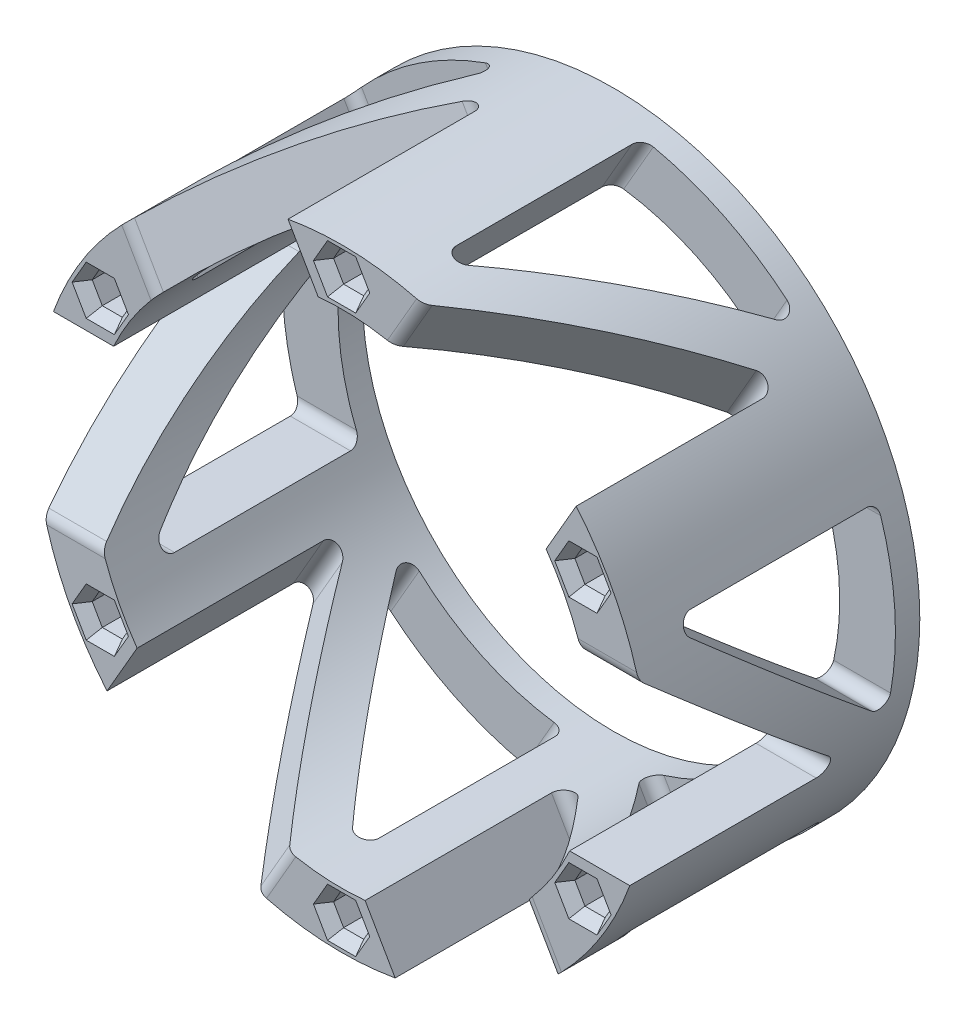
from build123d import *
from OCP.BRepFilletAPI import BRepFilletAPI_MakeChamfer

# Parameters (mm, degrees)
SKETCH_1_R                       = 44
SKETCH_1_R_2                     = 36
EXTRUDE_1_DEPTH                  = 39
CUT_EXTRUDE_6_DEPTH              = 59
FILLET_1_R                       = 2
PATTERN_CIRCULAR_1_COUNT         = 6
FILLET_1_OF_PATTERN_CIRCULAR_1_R = 2
SKETCH_8_R                       = 1.6
EXTRUDE_2_DEPTH                  = 6.7
CHAMFER_1_SIZE                   = 1
CHAMFER_1_SIZE2                  = 1.732050808


with BuildPart() as part:
    # 草图1 → 凸台-拉伸1 (new body)
    with BuildSketch(Plane.XY):
        Circle(SKETCH_1_R)
        Circle(SKETCH_1_R_2, mode=Mode.SUBTRACT)
        Polygon((36.084391824, 17.5), (37.527767497, 20), (36.084391824, 22.5), (33.197640478, 22.5), (31.754264805, 20), (33.197640478, 17.5), align=None, mode=Mode.SUBTRACT)
        Polygon((2.886751346, 40), (1.443375673, 42.5), (-1.443375673, 42.5), (-2.886751346, 40), (-1.443375673, 37.5), (1.443375673, 37.5), align=None, mode=Mode.SUBTRACT)
        Polygon((33.197640478, -22.5), (36.084391824, -22.5), (37.527767497, -20), (36.084391824, -17.5), (33.197640478, -17.5), (31.754264805, -20), align=None, mode=Mode.SUBTRACT)
        Polygon((-2.886751346, -40), (-1.443375673, -42.5), (1.443375673, -42.5), (2.886751346, -40), (1.443375673, -37.5), (-1.443375673, -37.5), align=None, mode=Mode.SUBTRACT)
        Polygon((-36.084391824, -17.5), (-37.527767497, -20), (-36.084391824, -22.5), (-33.197640478, -22.5), (-31.754264805, -20), (-33.197640478, -17.5), align=None, mode=Mode.SUBTRACT)
        Polygon((-33.197640478, 22.5), (-36.084391824, 22.5), (-37.527767497, 20), (-36.084391824, 17.5), (-33.197640478, 17.5), (-31.754264805, 20), align=None, mode=Mode.SUBTRACT)
    extrude(amount=EXTRUDE_1_DEPTH)

    # 草图7 → 切除-拉伸6 (cut)
    with BuildSketch(Plane(origin=(0, 0, 0), x_dir=(0, 0, -1), z_dir=(1, 0, 0))):
        with BuildLine():
            Line((-30.253226553, -15), (-5, -15))
            ThreePointArc((-5, -15), (-3.939339828, -14.560660172), (-3.5, -13.5))
            Line((-3.5, -13.5), (-3.5, 7.840754833))
            ThreePointArc((-3.5, 7.840754833), (-4.368448226, 9.201321758), (-5.968189809, 8.986446107))
            Line((-5.968189809, 8.986446107), (-31.221416361, -12.354308726))
            ThreePointArc((-31.221416361, -12.354308726), (-31.661867194, -14.015491556), (-30.253226553, -15))
        make_face()
        with BuildLine():
            Line((-39, -11.072240311), (-39, 15))
            Line((-39, 15), (-12.246773447, 15))
            ThreePointArc((-12.246773447, 15), (-10.838132806, 14.015491556), (-11.278583639, 12.354308726))
            Line((-11.278583639, 12.354308726), (-39, -11.072240311))
        make_face()
    cut_extrude_6 = extrude(amount=-CUT_EXTRUDE_6_DEPTH, mode=Mode.SUBTRACT)

    # 圆角1
    fillet_1_edges = [part.edges().sort_by_distance(p)[0] for p in [
        (-38.419552967, -11.072240311, 39),
    ]]
    fillet(fillet_1_edges, radius=FILLET_1_R)

    # 阵列(圆周)1: 切除-拉伸6 ×6 about axis
    pattern_circular_1_axis = Axis((0, 0, 0), (0, 0, 1))
    for i in range(1, PATTERN_CIRCULAR_1_COUNT):
        add(cut_extrude_6.rotate(pattern_circular_1_axis, i * 360 / PATTERN_CIRCULAR_1_COUNT), mode=Mode.SUBTRACT)

    # 圆角1 of 阵列(圆周)1
    fillet_1_of_pattern_circular_1_edges = [part.edges().sort_by_distance(p)[0] for p in [
        (-9.620935097, -38.808429027, 39),
        (28.79861787, -27.736188715, 39),
        (38.419552967, 11.072240311, 39),
        (9.620935097, 38.808429027, 39),
        (-28.79861787, 27.736188715, 39),
    ]]
    fillet(fillet_1_of_pattern_circular_1_edges, radius=FILLET_1_OF_PATTERN_CIRCULAR_1_R)

    # 草图8 → 凸台-拉伸2 (add)
    # profile 1 of 6: a face of its own
    with BuildSketch(Plane.XY):
        Polygon((-1.443375673, 42.5), (-2.886751346, 40), (-1.443375673, 37.5), (1.443375673, 37.5), (2.886751346, 40), (1.443375673, 42.5), align=None)
        with Locations((0, 40)):
            Circle(SKETCH_8_R, mode=Mode.SUBTRACT)
    # profile 2 of 6: a face of its own
    with BuildSketch(Plane.XY):
        Polygon((36.084391824, 22.5), (33.197640478, 22.5), (31.754264805, 20), (33.197640478, 17.5), (36.084391824, 17.5), (37.527767497, 20), align=None)
        with Locations((34.641016151, 20)):
            Circle(SKETCH_8_R, mode=Mode.SUBTRACT)
    # profile 3 of 6: a face of its own
    with BuildSketch(Plane.XY):
        Polygon((37.527767497, -20), (36.084391824, -17.5), (33.197640478, -17.5), (31.754264805, -20), (33.197640478, -22.5), (36.084391824, -22.5), align=None)
        with Locations((34.641016151, -20)):
            Circle(SKETCH_8_R, mode=Mode.SUBTRACT)
    # profile 4 of 6: a face of its own
    with BuildSketch(Plane.XY):
        Polygon((1.443375673, -42.5), (2.886751346, -40), (1.443375673, -37.5), (-1.443375673, -37.5), (-2.886751346, -40), (-1.443375673, -42.5), align=None)
        with Locations((0, -40)):
            Circle(SKETCH_8_R, mode=Mode.SUBTRACT)
    # profile 5 of 6: a face of its own
    with BuildSketch(Plane.XY):
        Polygon((-36.084391824, -22.5), (-33.197640478, -22.5), (-31.754264805, -20), (-33.197640478, -17.5), (-36.084391824, -17.5), (-37.527767497, -20), align=None)
        with Locations((-34.641016151, -20)):
            Circle(SKETCH_8_R, mode=Mode.SUBTRACT)
    # profile 6 of 6: a face of its own
    with BuildSketch(Plane.XY):
        Polygon((-37.527767497, 20), (-36.084391824, 17.5), (-33.197640478, 17.5), (-31.754264805, 20), (-33.197640478, 22.5), (-36.084391824, 22.5), align=None)
        with Locations((-34.641016151, 20)):
            Circle(SKETCH_8_R, mode=Mode.SUBTRACT)
    extrude(amount=EXTRUDE_2_DEPTH)

    # 倒角1: one chamfer whose edges measure the first distance from different faces: ONE call of the kernel's chamfer builder (chamfer() names one face for all edges)
    chamfer_1_edges_1 = [part.edges().sort_by_distance(p)[0] for p in [
        (-32.475952642, 21.25, 39),
        (-34.641016151, 22.5, 39),
        (-36.806079661, 21.25, 39),
        (-36.806079661, 18.75, 39),
        (-34.641016151, 17.5, 39),
        (-32.475952642, 18.75, 39),
    ]]
    chamfer_1_side_1 = [part.faces().sort_by_distance(p)[0] for p in [
        (-30.513411317, 19.496164585, 39),
    ]]
    chamfer_1_edges_2 = [part.edges().sort_by_distance(p)[0] for p in [
        (34.641016151, 17.5, 39),
        (36.806079661, 18.75, 39),
        (36.806079661, 21.25, 39),
        (34.641016151, 22.5, 39),
        (32.475952642, 21.25, 39),
        (32.475952642, 18.75, 39),
    ]]
    chamfer_1_side_2 = [part.faces().sort_by_distance(p)[0] for p in [
        (32.139517126, 16.676600172, 39),
    ]]
    chamfer_1_edges_3 = [part.edges().sort_by_distance(p)[0] for p in [
        (2.165063509, 38.75, 39),
        (2.165063509, 41.25, 39),
        (0, 42.5, 39),
        (-2.165063509, 41.25, 39),
        (-2.165063509, 38.75, 39),
        (0, 37.5, 39),
    ]]
    chamfer_1_side_3 = [part.faces().sort_by_distance(p)[0] for p in [
        (1.62718298, 36.167133255, 39),
    ]]
    chamfer_1_edges_4 = [part.edges().sort_by_distance(p)[0] for p in [
        (32.475952642, -21.25, 39),
        (34.641016151, -22.5, 39),
        (36.806079661, -21.25, 39),
        (36.806079661, -18.75, 39),
        (34.641016151, -17.5, 39),
        (32.475952642, -18.75, 39),
    ]]
    chamfer_1_side_4 = [part.faces().sort_by_distance(p)[0] for p in [
        (30.513411317, -19.496164585, 39),
    ]]
    chamfer_1_edges_5 = [part.edges().sort_by_distance(p)[0] for p in [
        (-2.165063509, -38.75, 39),
        (-2.165063509, -41.25, 39),
        (0, -42.5, 39),
        (2.165063509, -41.25, 39),
        (2.165063509, -38.75, 39),
        (0, -37.5, 39),
    ]]
    chamfer_1_side_5 = [part.faces().sort_by_distance(p)[0] for p in [
        (-1.62718298, -36.167133255, 39),
    ]]
    chamfer_1_edges_6 = [part.edges().sort_by_distance(p)[0] for p in [
        (-34.641016151, -17.5, 39),
        (-36.806079661, -18.75, 39),
        (-36.806079661, -21.25, 39),
        (-34.641016151, -22.5, 39),
        (-32.475952642, -21.25, 39),
        (-32.475952642, -18.75, 39),
    ]]
    chamfer_1_side_6 = [part.faces().sort_by_distance(p)[0] for p in [
        (-38.136380236, -12.209134678, 39),
    ]]
    chamfer_1 = BRepFilletAPI_MakeChamfer(part.part.solid().wrapped)
    for e in chamfer_1_edges_1:
        chamfer_1.Add(CHAMFER_1_SIZE, CHAMFER_1_SIZE2, e.wrapped, chamfer_1_side_1[0].wrapped)  # the first distance lies on this face
    for e in chamfer_1_edges_2:
        chamfer_1.Add(CHAMFER_1_SIZE, CHAMFER_1_SIZE2, e.wrapped, chamfer_1_side_2[0].wrapped)  # the first distance lies on this face
    for e in chamfer_1_edges_3:
        chamfer_1.Add(CHAMFER_1_SIZE, CHAMFER_1_SIZE2, e.wrapped, chamfer_1_side_3[0].wrapped)  # the first distance lies on this face
    for e in chamfer_1_edges_4:
        chamfer_1.Add(CHAMFER_1_SIZE, CHAMFER_1_SIZE2, e.wrapped, chamfer_1_side_4[0].wrapped)  # the first distance lies on this face
    for e in chamfer_1_edges_5:
        chamfer_1.Add(CHAMFER_1_SIZE, CHAMFER_1_SIZE2, e.wrapped, chamfer_1_side_5[0].wrapped)  # the first distance lies on this face
    for e in chamfer_1_edges_6:
        chamfer_1.Add(CHAMFER_1_SIZE, CHAMFER_1_SIZE2, e.wrapped, chamfer_1_side_6[0].wrapped)  # the first distance lies on this face
    add(Compound.cast(chamfer_1.Shape()), mode=Mode.REPLACE)


solid = part.part
